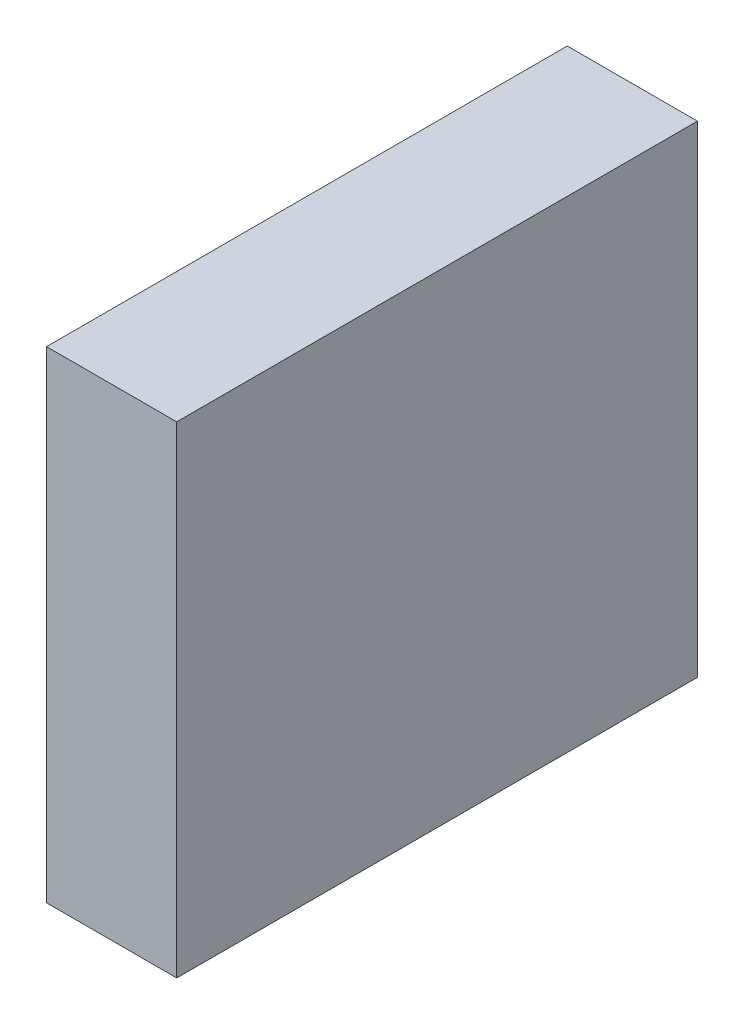
from build123d import *

# Parameters (mm, degrees)
SKETCH1_W           = 40
SKETCH1_H           = 37
BOSS_EXTRUDE1_DEPTH = 10


with BuildPart() as part:
    # Sketch1 → Boss-Extrude1 (new body)
    with BuildSketch(Plane(origin=(0, 0, 0), x_dir=(0, 0, -1), z_dir=(1, 0, 0))):
        with Locations((20, 18.5)):
            Rectangle(SKETCH1_W, SKETCH1_H)
    extrude(amount=BOSS_EXTRUDE1_DEPTH)


solid = part.part
